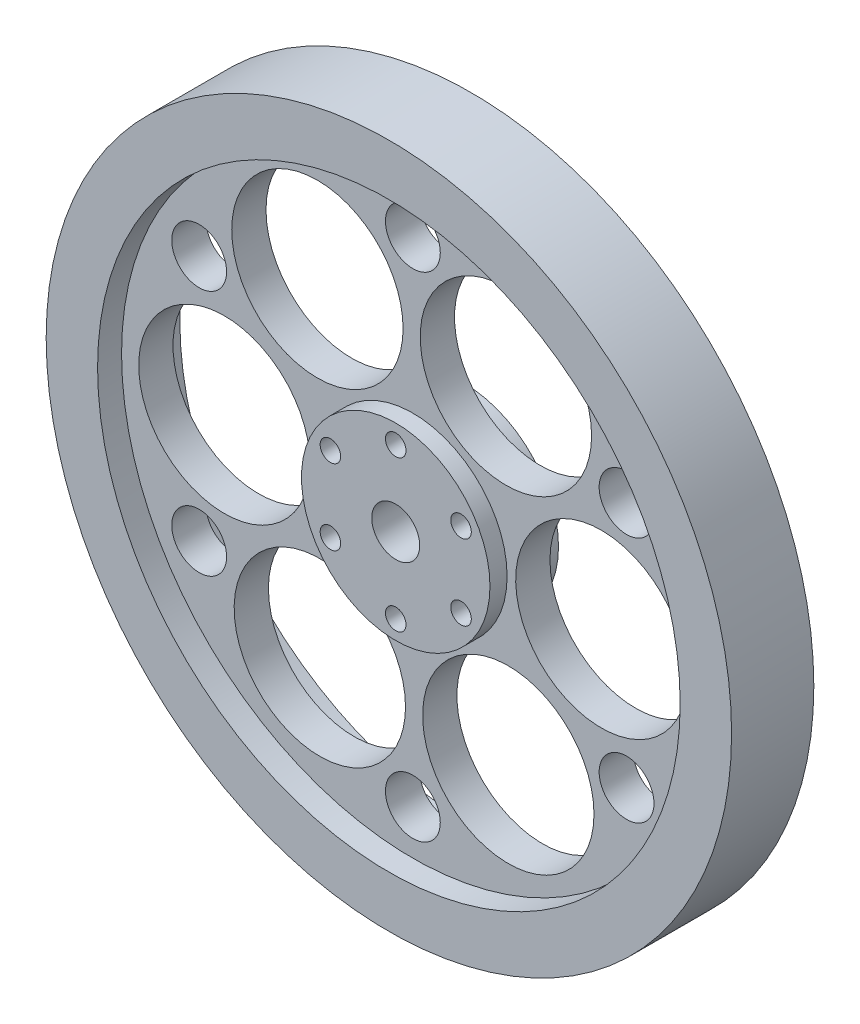
from build123d import *

# Parameters (mm, degrees)
BOSS_EXTRUDE1_DEPTH      = 10
BOSS_EXTRUDE1_DEPTH_BACK = 10
SKETCH1_R                = 27.5
BOSS_EXTRUDE2_DEPTH      = 12
BOSS_EXTRUDE2_DEPTH_BACK = 12
SKETCH1_3_R              = 100
SKETCH1_3_R_2            = 85
BOSS_EXTRUDE3_DEPTH      = 5
BOSS_EXTRUDE3_DEPTH_BACK = 5
SKETCH1_4_R              = 85
SKETCH1_4_R_2            = 27.5
SKETCH2_R                = 7
CUT_EXTRUDE1_DEPTH       = 144.122325303
SKETCH3_R                = 3
SKETCH3_R_2              = 8
CUT_EXTRUDE2_DEPTH       = 144.122325303
SKETCH4_R                = 25
CUT_EXTRUDE3_DEPTH       = 143.439460825
CIRPATTERN1_COUNT        = 6


with BuildPart() as part:
    # Sketch1 → Boss-Extrude1 (new, two sides: drawn at the far end of the back side and taken through both)
    with BuildSketch(Plane.XY.offset(-BOSS_EXTRUDE1_DEPTH_BACK)):
        Circle(SKETCH1_R)
    extrude(amount=BOSS_EXTRUDE1_DEPTH + BOSS_EXTRUDE1_DEPTH_BACK)



with BuildPart() as body_2:
    # Sketch1<3> → Boss-Extrude2 (new, two sides: drawn at the far end of the back side and taken through both)
    with BuildSketch(Plane.XY.offset(-BOSS_EXTRUDE2_DEPTH_BACK)):
        Circle(SKETCH1_3_R)
        Circle(SKETCH1_3_R_2, mode=Mode.SUBTRACT)
    extrude(amount=BOSS_EXTRUDE2_DEPTH + BOSS_EXTRUDE2_DEPTH_BACK)


with BuildPart() as part_1:
    add(part.part)

    add(body_2.part)  # Boss-Extrude3 merges body 2
    # Sketch1<4> → Boss-Extrude3 (add, two sides: drawn at the far end of the back side and taken through both)
    with BuildSketch(Plane.XY.offset(-BOSS_EXTRUDE3_DEPTH_BACK)):
        Circle(SKETCH1_4_R)
        Circle(SKETCH1_4_R_2, mode=Mode.SUBTRACT)
    extrude(amount=BOSS_EXTRUDE3_DEPTH + BOSS_EXTRUDE3_DEPTH_BACK)

    # Sketch2 → Cut-Extrude1 (cut, through all)
    with BuildSketch(Plane.XY.offset(10)):
        Circle(SKETCH2_R)
    extrude(amount=-CUT_EXTRUDE1_DEPTH, mode=Mode.SUBTRACT)

    # Sketch3 → Cut-Extrude2 (cut, through all)
    with BuildSketch(Plane.XY.offset(10)):
        with Locations((19.052558883, 11)):
            Circle(SKETCH3_R)
        with Locations((19.052558883, -11)):
            Circle(SKETCH3_R)
        with Locations((0, 22)):
            Circle(SKETCH3_R)
        with Locations((0, -22)):
            Circle(SKETCH3_R)
        with Locations((-19.052558883, 11)):
            Circle(SKETCH3_R)
        with Locations((-19.052558883, -11)):
            Circle(SKETCH3_R)
        with Locations((62.353829072, 36)):
            Circle(SKETCH3_R_2)
        with Locations((62.353829072, -36)):
            Circle(SKETCH3_R_2)
        with Locations((0, 72)):
            Circle(SKETCH3_R_2)
        with Locations((0, -72)):
            Circle(SKETCH3_R_2)
        with Locations((-62.353829072, 36)):
            Circle(SKETCH3_R_2)
        with Locations((-62.353829072, -36)):
            Circle(SKETCH3_R_2)
    extrude(amount=-CUT_EXTRUDE2_DEPTH, mode=Mode.SUBTRACT)

    # Sketch4 → Cut-Extrude3 (cut, through all)
    with BuildSketch(Plane(origin=(0, 0, -5), x_dir=(-1, 0, 0), z_dir=(0, 0, -1))):
        with Locations((27.851651468, 47.426632924)):
            Circle(SKETCH4_R)
    cut_extrude3 = extrude(amount=-CUT_EXTRUDE3_DEPTH, mode=Mode.SUBTRACT)

    # CirPattern1: Cut-Extrude3 ×6 about axis
    cirpattern1_axis = Axis((0, 0, -10), (0, 0, 1))
    for i in range(1, CIRPATTERN1_COUNT):
        add(cut_extrude3.rotate(cirpattern1_axis, i * 360 / CIRPATTERN1_COUNT), mode=Mode.SUBTRACT)


solid = part_1.part
